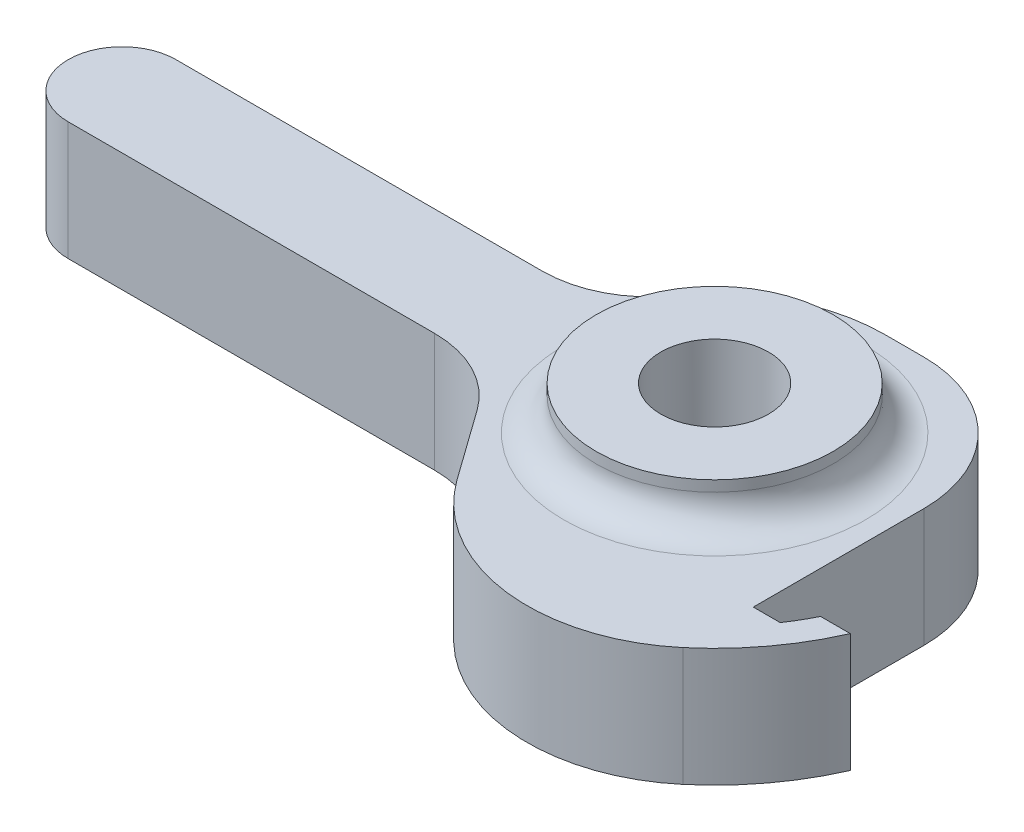
from build123d import *

# Parameters (mm, degrees)
BOSS_EXTRUDE1_START = -2
SKETCH1_R           = 2.5
BOSS_EXTRUDE1_DEPTH = 5.5
BOSS_EXTRUDE2_REACH = 96.094
SKETCH2_R           = 5.5
SKETCH2_R_2         = 2.5
FILLET1_R           = 1.5


with BuildPart() as part:
    # Sketch1 → Boss-Extrude1 (new body)
    with BuildSketch(Plane(origin=(0, -76.733621845, 0), x_dir=(1, 0, 0), z_dir=(0, 1, 0)).offset(BOSS_EXTRUDE1_START)):
        with BuildLine():
            Line((52.941217068, 9.5), (69.945503657, 9.5))
            ThreePointArc((69.945503657, 9.5), (72.232982212, 8.946059138), (74.01360963, 7.406976744))
            Line((74.01360963, 7.406976744), (76.346988808, 4.141579527))
            ThreePointArc((76.346988808, 4.141579527), (82.014772389, 0.763045112), (88.341217068, 2.637708614))
            ThreePointArc((88.341217068, 2.637708614), (90.254455743, 4.667684765), (91.658842367, 7.07786808))
            Line((91.658842367, 7.07786808), (90.278524492, 7.07786808))
            ThreePointArc((90.278524492, 7.07786808), (89.953291089, 6.475468544), (89.591215146, 5.89446684))
            Line((89.591215146, 5.89446684), (88.341217068, 5.89446684))
            Line((88.341217068, 5.89446684), (88.341217068, 12))
            Line((88.341217068, 12), (88.341217068, 13.810660172))
            ThreePointArc((88.341217068, 13.810660172), (86.557690725, 18.116473657), (82.25187724, 19.9))
            Line((82.25187724, 19.9), (80.441217068, 19.9))
            ThreePointArc((80.441217068, 19.9), (76.827000951, 19.024773438), (74.01360963, 16.593023256))
            ThreePointArc((74.01360963, 16.593023256), (72.232982212, 15.053940862), (69.945503657, 14.5))
            Line((69.945503657, 14.5), (52.941217068, 14.5))
            ThreePointArc((52.941217068, 14.5), (50.441217068, 12), (52.941217068, 9.5))
        make_face()
        with Locations(Location((80.441217068, 12, 0), (0, 0, 270))):
            Circle(SKETCH1_R, mode=Mode.SUBTRACT)
    extrude(amount=-BOSS_EXTRUDE1_DEPTH)

    # Sketch2 → Boss-Extrude2 (add, up to next)
    with BuildSketch(Plane(origin=(0, -76.733621845, 0), x_dir=(-1, 0, 0), z_dir=(0, -1, 0)), mode=Mode.PRIVATE) as boss_extrude2_sk1:
        with Locations(Location((-80.441217068, 12, 0), (0, 0, 270))):
            Circle(SKETCH2_R)
        with Locations(Location((-80.441217068, 12, 0), (0, 0, 270))):
            Circle(SKETCH2_R_2, mode=Mode.SUBTRACT)
    boss_extrude2_tool1 = extrude(boss_extrude2_sk1.sketch, amount=BOSS_EXTRUDE2_REACH, mode=Mode.PRIVATE) - part.part
    add(boss_extrude2_tool1.solids().sort_by_distance((80.441217, -76.733622, -17.344437))[0])

    # Fillet1
    fillet1_edges = [part.edges().sort_by_distance(p)[0] for p in [
        (80.441217068, -78.733621845, -17.5),
    ]]
    fillet(fillet1_edges, radius=FILLET1_R)


solid = part.part
